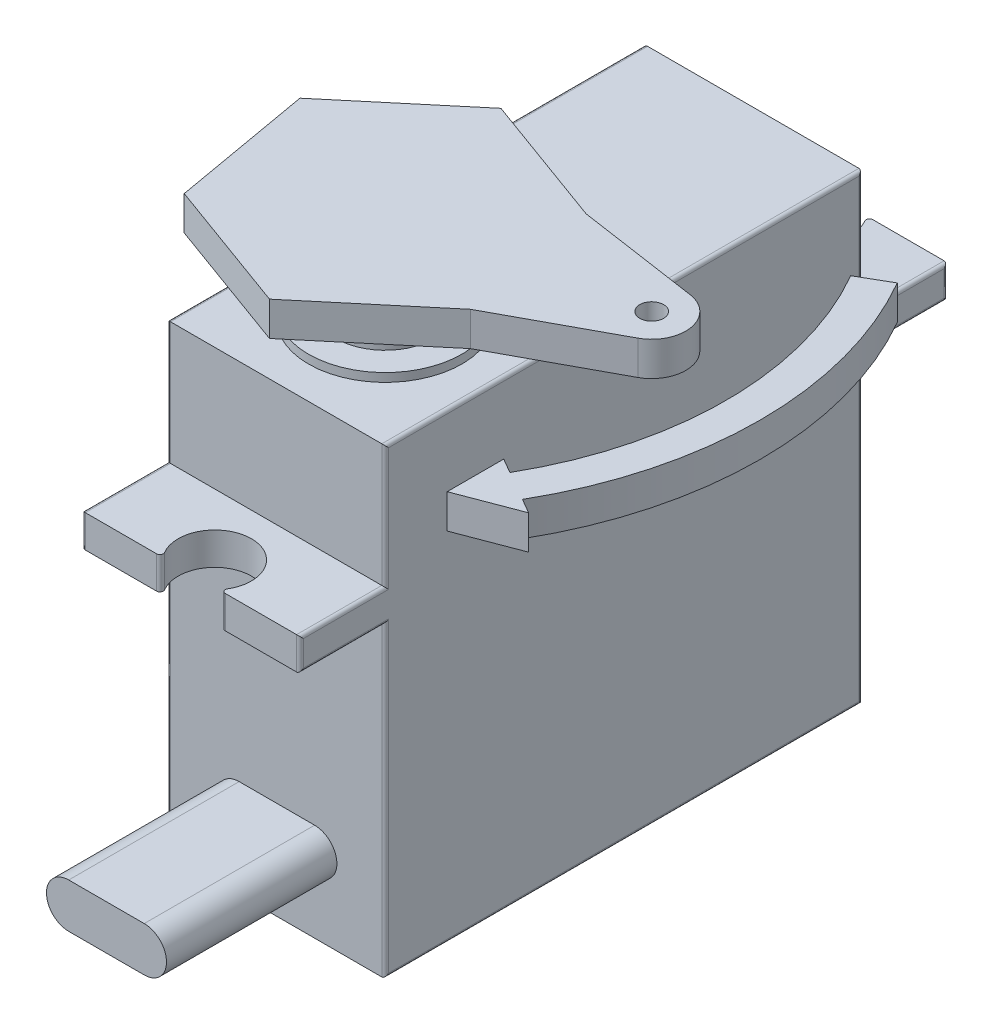
from build123d import *

# Parameters (mm, degrees)
SKETCH_1_W      = 12.8
SKETCH_1_H      = 28
EXTRUDE_1_DEPTH = 18
EXTRUDE_2_DEPTH = 1.9
SKETCH_3_W      = 12.8
SKETCH_3_H      = 28
EXTRUDE_3_DEPTH = 7.2
SKETCH_4_R      = 4.5
EXTRUDE_4_DEPTH = 0.5
SKETCH_5_R      = 2.9
EXTRUDE_5_DEPTH = 3.9
FILLET_1_R      = 0.2
EXTRUDE_6_DEPTH = 10
SKETCH_7_R      = 0.7
EXTRUDE_7_DEPTH = 2


with BuildPart() as part:
    # 草图1 → 凸台-拉伸1 (new body)
    with BuildSketch(Plane(origin=(0, 0, 0), x_dir=(1, 0, 0), z_dir=(0, 1, 0))):
        Rectangle(SKETCH_1_W, SKETCH_1_H)
    extrude(amount=EXTRUDE_1_DEPTH)

    # 草图2 → 凸台-拉伸2 (add)
    with BuildSketch(Plane(origin=(0, 18, 0), x_dir=(1, 0, 0), z_dir=(0, 1, 0))):
        with BuildLine():
            Line((-6.4, 19), (-2.020519735, 19))
            ThreePointArc((-2.020519735, 19), (-1.846701537, 18.898930451), (-1.848560609, 18.69787234))
            ThreePointArc((-1.848560609, 18.69787234), (0, 15.45), (1.848560609, 18.69787234))
            ThreePointArc((1.848560609, 18.69787234), (1.846701537, 18.898930451), (2.020519735, 19))
            Line((2.020519735, 19), (6.4, 19))
            Line((6.4, 19), (6.4, -19))
            Line((6.4, -19), (2.020519735, -19))
            ThreePointArc((2.020519735, -19), (1.846701537, -18.898930451), (1.848560609, -18.69787234))
            ThreePointArc((1.848560609, -18.69787234), (0, -15.45), (-1.848560609, -18.69787234))
            ThreePointArc((-1.848560609, -18.69787234), (-1.846701537, -18.898930451), (-2.020519735, -19))
            Line((-2.020519735, -19), (-6.4, -19))
            Line((-6.4, -19), (-6.4, 19))
        make_face()
    extrude(amount=EXTRUDE_2_DEPTH)

    # 草图3 → 凸台-拉伸3 (add)
    with BuildSketch(Plane(origin=(0, 19.9, 0), x_dir=(1, 0, 0), z_dir=(0, 1, 0))):
        Rectangle(SKETCH_3_W, SKETCH_3_H)
    extrude(amount=EXTRUDE_3_DEPTH)

    # 草图4 → 凸台-拉伸4 (add)
    with BuildSketch(Plane(origin=(0, 27.1, 0), x_dir=(1, 0, 0), z_dir=(0, 1, 0))):
        with Locations(Location((0, -7.6, 0), (0, 0, 270))):
            Circle(SKETCH_4_R)
    extrude(amount=EXTRUDE_4_DEPTH)

    # 草图5 → 凸台-拉伸5 (add)
    with BuildSketch(Plane(origin=(0, 27.6, 0), x_dir=(1, 0, 0), z_dir=(0, 1, 0))):
        with Locations(Location((0, -7.6, 0), (0, 0, 270))):
            Circle(SKETCH_5_R)
    extrude(amount=EXTRUDE_5_DEPTH)

    # 圆角1
    fillet_1_edges = [part.edges().sort_by_distance(p)[0] for p in [
        (6.4, 9, 14),
        (6.4, 18, 16.5),
        (6.4, 18.95, 19),
        (6.4, 19.9, 16.5),
        (6.4, 23.5, 14),
        (6.4, 27.1, 0),
        (6.4, 23.5, -14),
        (6.4, 19.9, -16.5),
        (6.4, 18.95, -19),
        (6.4, 18, -16.5),
        (6.4, 9, -14),
        (6.4, 0, 0),
        (-6.4, 9, -14),
        (-6.4, 18, -16.5),
        (-6.4, 18.95, -19),
        (-6.4, 19.9, -16.5),
        (-6.4, 23.5, -14),
        (-6.4, 27.1, 0),
        (-6.4, 23.5, 14),
        (-6.4, 19.9, 16.5),
        (-6.4, 18.95, 19),
        (-6.4, 18, 16.5),
        (-6.4, 9, 14),
        (-6.4, 0, 0),
    ]]
    fillet(fillet_1_edges, radius=FILLET_1_R)

    # 草图6 → 凸台-拉伸6 (add)
    with BuildSketch(Plane.XY.offset(14)):
        with BuildLine():
            Line((-2.17212992, 5.7438306), (2.258112685, 5.7438306))
            ThreePointArc((2.258112685, 5.7438306), (3.564466274, 4.437477011), (2.258112685, 3.131123422))
            Line((2.258112685, 3.131123422), (-2.17212992, 3.131123422))
            ThreePointArc((-2.17212992, 3.131123422), (-3.478483509, 4.437477011), (-2.17212992, 5.7438306))
        make_face()
    extrude(amount=EXTRUDE_6_DEPTH)

    # 草图7 → 凸台-拉伸7 (add)
    # profile 1 of 2: a face of its own
    with BuildSketch(Plane(origin=(0, 31, 0), x_dir=(1, 0, 0), z_dir=(0, 1, 0))):
        with BuildLine():
            Line((6.413001499, -2.218852807), (13.586794799, -3.27716421))
            ThreePointArc((13.586794799, -3.27716421), (15.264520172, -4.908453246), (14.245907729, -7.015179388))
            Line((14.245907729, -7.015179388), (7.86671092, -10.463248616))
            Line((7.86671092, -10.463248616), (1.453709421, -15.844395809))
            Line((1.453709421, -15.844395809), (-6.413001499, -12.981147193))
            Line((-6.413001499, -12.981147193), (-7.86671092, -4.736751384))
            Line((-7.86671092, -4.736751384), (-1.453709421, 0.644395809))
            Line((-1.453709421, 0.644395809), (6.413001499, -2.218852807))
        make_face()
        with Locations(Location((13.294904666, -5.255749601, 0), (0, 0, 270))):
            Circle(SKETCH_7_R, mode=Mode.SUBTRACT)
    # profile 2 of 2: a face of its own
    with BuildSketch(Plane(origin=(0, 31, 0), x_dir=(1, 0, 0), z_dir=(0, 1, 0))):
        with BuildLine():
            Line((16.454482672, -17.1), (16.454482672, -20.416255395))
            Line((16.454482672, -20.416255395), (19.918584287, -19.1))
            Line((19.918584287, -19.1), (19.052558883, -18.6))
            ThreePointArc((19.052558883, -18.6), (22, -7.6), (19.052558883, 3.4))
            Line((19.052558883, 3.4), (17.320508076, 2.4))
            ThreePointArc((17.320508076, 2.4), (20, -7.6), (17.320508076, -17.6))
            Line((17.320508076, -17.6), (16.454482672, -17.1))
        make_face()
    extrude(amount=EXTRUDE_7_DEPTH)


with BuildPart() as extrude_7_piece_1:
    # of the separate pieces the step leaves, piece 1, a body of its own (extrude_7_pieces)
    add(part.part.solids().sort_by_distance((6.2, 18, 19))[0])


with BuildPart() as extrude_7_piece_2:
    # of the separate pieces the step leaves, piece 2, a body of its own (extrude_7_pieces)
    add(part.part.solids().sort_by_distance((17.320508076, 31, 17.6))[0])


solid = Compound([extrude_7_piece_1.part, extrude_7_piece_2.part])
